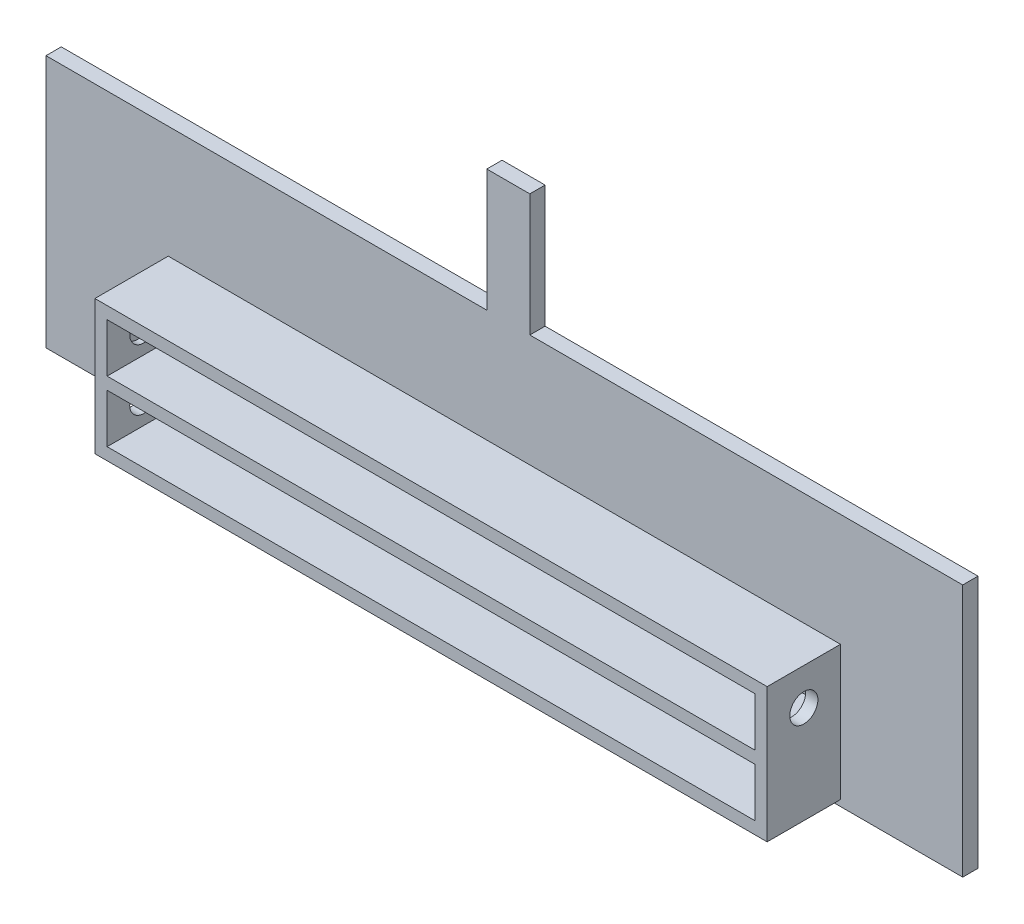
from build123d import *

# Parameters (mm, degrees)
SKETCH1_W           = 150
SKETCH1_H           = 41.41
BOSS_EXTRUDE1_DEPTH = 2.5
SKETCH5_W           = 110
SKETCH5_H           = 22
BOSS_EXTRUDE3_DEPTH = 12
SKETCH6_W           = 106
SKETCH6_H           = 8
CUT_EXTRUDE3_DEPTH  = 12
SKETCH7_R           = 2.3
CUT_EXTRUDE4_DEPTH  = 109
SKETCH8_R           = 2.3
CUT_EXTRUDE5_DEPTH  = 109
SKETCH9_W           = 7.040043687
SKETCH9_H           = 2.5
BOSS_EXTRUDE4_DEPTH = 20


with BuildPart() as part:
    # Sketch1 → Boss-Extrude1 (new body)
    with BuildSketch(Plane.XY):
        with Locations((0, 8.705)):
            Rectangle(SKETCH1_W, SKETCH1_H)
    extrude(amount=BOSS_EXTRUDE1_DEPTH)

    # Sketch5 → Boss-Extrude3 (add)
    with BuildSketch(Plane.XY.offset(2.5)):
        Rectangle(SKETCH5_W, SKETCH5_H)
    extrude(amount=BOSS_EXTRUDE3_DEPTH)

    # Sketch6 → Cut-Extrude3 (cut)
    with BuildSketch(Plane.XY.offset(2.5)):
        with Locations((0, 5)):
            Rectangle(SKETCH6_W, SKETCH6_H)
        with Locations((0, -5)):
            Rectangle(SKETCH6_W, SKETCH6_H)
    extrude(amount=CUT_EXTRUDE3_DEPTH, mode=Mode.SUBTRACT)

    # Sketch7 → Cut-Extrude4 (cut)
    with BuildSketch(Plane.ZY.offset(55)):
        with Locations((8.5, -5)):
            Circle(SKETCH7_R)
    extrude(amount=-CUT_EXTRUDE4_DEPTH, mode=Mode.SUBTRACT)

    # Sketch8 → Cut-Extrude5 (cut)
    with BuildSketch(Plane(origin=(55, 0, 0), x_dir=(0, 0, -1), z_dir=(1, 0, 0))):
        with Locations((-8.5, 5)):
            Circle(SKETCH8_R)
    extrude(amount=-CUT_EXTRUDE5_DEPTH, mode=Mode.SUBTRACT)

    # Sketch9 → Boss-Extrude4 (add)
    with BuildSketch(Plane(origin=(0, 29.41, 0), x_dir=(1, 0, 0), z_dir=(0, 1, 0))):
        with Locations((0.645201015, -1.25)):
            Rectangle(SKETCH9_W, SKETCH9_H)
    extrude(amount=BOSS_EXTRUDE4_DEPTH)


solid = part.part
